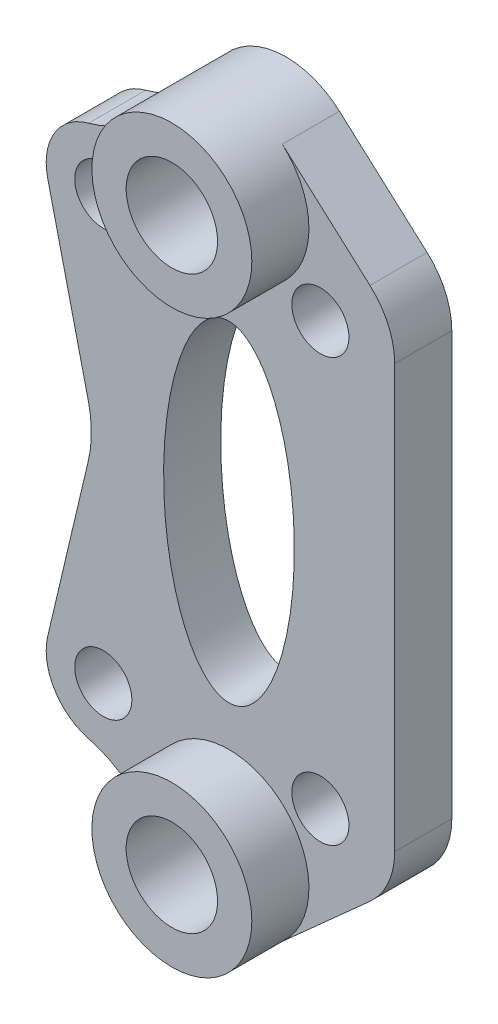
from build123d import *

# Parameters (mm, degrees)
SKETCH1_R           = 2.5
SKETCH1_R_2         = 4
BOSS_EXTRUDE1_DEPTH = 5
SKETCH1_8_R         = 7
SKETCH1_8_R_2       = 4
BOSS_EXTRUDE2_DEPTH = 10


with BuildPart() as part:
    # Sketch1 → Boss-Extrude1 (new body)
    with BuildSketch(Plane.XY):
        with BuildLine():
            ThreePointArc((-12.280942298, 23.333134266), (-15.288355998, 21.070992578), (-15.866532295, 17.352453301))
            Line((-15.866532295, 17.352453301), (-12.315949948, 2.295093398))
            ThreePointArc((-12.315949948, 2.295093398), (-12.049014537, 0), (-12.315949948, -2.295093398))
            Line((-12.315949948, -2.295093398), (-15.866532295, -17.352453301))
            ThreePointArc((-15.866532295, -17.352453301), (-15.288355998, -21.070992578), (-12.280942298, -23.333134266))
            ThreePointArc((-12.280942298, -23.333134266), (-8.735645415, -25.125829666), (-6.223821311, -28.203755341))
            ThreePointArc((-6.223821311, -28.203755341), (-1.270654935, -31.883708015), (4.669885757, -30.214610917))
            Line((4.669885757, -30.214610917), (12.339742456, -23.345957604))
            ThreePointArc((12.339742456, -23.345957604), (13.939159998, -21.153874186), (14.505126416, -18.5))
            Line((14.505126416, -18.5), (14.505126416, 18.5))
            ThreePointArc((14.505126416, 18.5), (13.939159998, 21.153874186), (12.339742456, 23.345957604))
            Line((12.339742456, 23.345957604), (4.669885757, 30.214610917))
            ThreePointArc((4.669885757, 30.214610917), (-1.270654935, 31.883708015), (-6.223821311, 28.203755341))
            ThreePointArc((-6.223821311, 28.203755341), (-8.735645415, 25.125829666), (-12.280942298, 23.333134266))
        make_face()
        with Locations((-11, -18.5)):
            Circle(SKETCH1_R, mode=Mode.SUBTRACT)
        with Locations((8, -18.5)):
            Circle(SKETCH1_R, mode=Mode.SUBTRACT)
        with Locations((-11, 18.5)):
            Circle(SKETCH1_R, mode=Mode.SUBTRACT)
        with BuildLine():
            add(Edge.make_bspline(
                [(0, 14.466895414), (-9.910654232, 14.466895414), (-4.955327116, -7.233447707), (0, -28.933790828), (4.955327116, -7.233447707), (9.910654232, 14.466895414), (0, 14.466895414)],
                knots=[0, 0, 0, 2.094395102, 2.094395102, 4.188790205, 4.188790205, 6.283185307, 6.283185307, 6.283185307], degree=2, weights=[1, 0.5, 1, 0.5, 1, 0.5, 1]))
        make_face(mode=Mode.SUBTRACT)
        with Locations((8, 18.5)):
            Circle(SKETCH1_R, mode=Mode.SUBTRACT)
        with Locations((0, 25)):
            Circle(SKETCH1_R_2, mode=Mode.SUBTRACT)
        with Locations((0, -25)):
            Circle(SKETCH1_R_2, mode=Mode.SUBTRACT)
    extrude(amount=BOSS_EXTRUDE1_DEPTH)

    # Sketch1<8> → Boss-Extrude2 (add)
    # profile 1 of 2: a face of its own
    with BuildSketch(Plane.XY):
        with Locations((0, 25)):
            Circle(SKETCH1_8_R)
        with Locations((0, 25)):
            Circle(SKETCH1_8_R_2, mode=Mode.SUBTRACT)
    # profile 2 of 2: a face of its own
    with BuildSketch(Plane.XY):
        with Locations((0, -25)):
            Circle(SKETCH1_8_R)
        with Locations((0, -25)):
            Circle(SKETCH1_8_R_2, mode=Mode.SUBTRACT)
    extrude(amount=BOSS_EXTRUDE2_DEPTH)


solid = part.part
